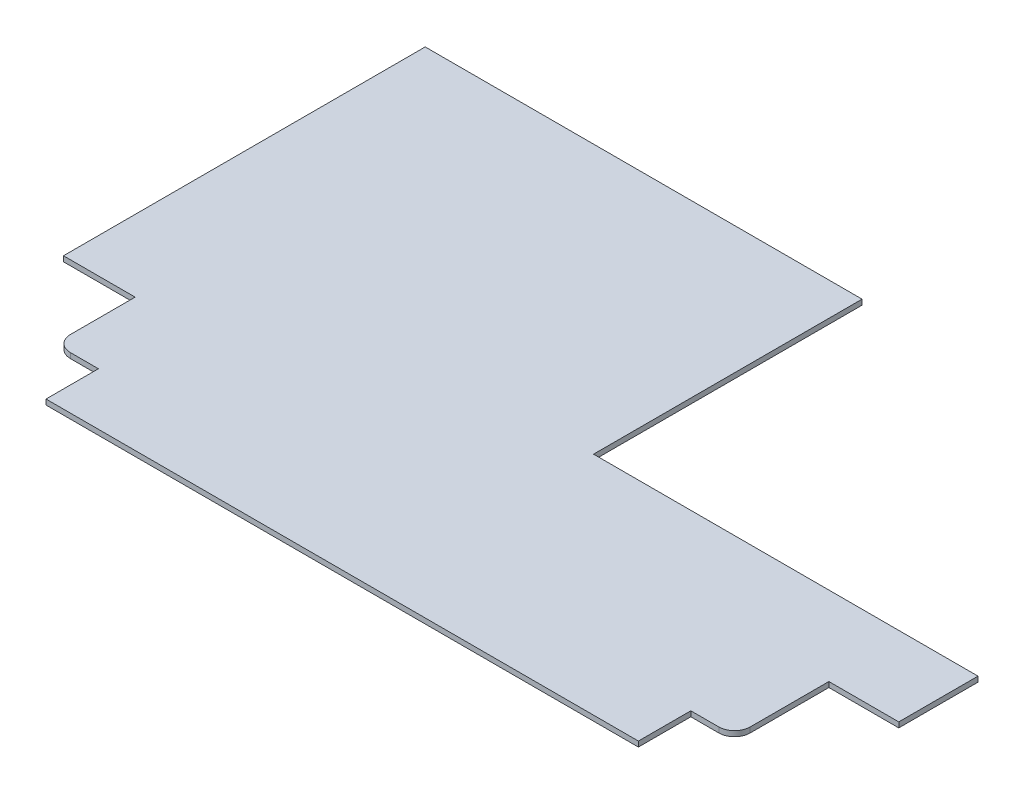
from build123d import *

# Parameters (mm, degrees)
CROQUIS1_W              = 250
CROQUIS1_H              = 250
SALIENTE_EXTRUIR1_DEPTH = 3
CROQUIS2_W              = 250
CROQUIS2_H              = 3
SALIENTE_EXTRUIR2_DEPTH = 3
CROQUIS3_W              = 220
CROQUIS3_H              = 99.34
SALIENTE_EXTRUIR4_DEPTH = 3
CROQUIS4_W              = 41
CROQUIS4_H              = 52
CORTAR_EXTRUIR1_DEPTH   = 3
CORTAR_EXTRUIR2_DEPTH   = 3
CROQUIS6_W              = 339
CROQUIS6_H              = 30
SALIENTE_EXTRUIR5_DEPTH = 3
CORTAR_EXTRUIR3_DEPTH   = 3
CROQUIS8_W              = 1
CROQUIS8_H              = 44
SALIENTE_EXTRUIR6_DEPTH = 3
SALIENTE_EXTRUIR7_DEPTH = 3
CROQUIS10_W             = 41
CROQUIS10_H             = 6
SALIENTE_EXTRUIR9_DEPTH = 3
CROQUIS11_W             = 40
CROQUIS11_H             = 1
CORTAR_EXTRUIR4_DEPTH   = 3


with BuildPart() as part:
    # Croquis1 → Saliente-Extruir1 (new body)
    with BuildSketch(Plane(origin=(0, 0, 0), x_dir=(1, 0, 0), z_dir=(0, 1, 0))):
        Rectangle(CROQUIS1_W, CROQUIS1_H)
    extrude(amount=SALIENTE_EXTRUIR1_DEPTH)

    # Croquis2 → Saliente-Extruir2 (add)
    with BuildSketch(Plane(origin=(0, 3, 0), x_dir=(1, 0, 0), z_dir=(0, 1, 0))):
        with Locations((0, 126.5)):
            Rectangle(CROQUIS2_W, CROQUIS2_H)
    extrude(amount=-SALIENTE_EXTRUIR2_DEPTH)

    # Croquis3 → Saliente-Extruir4 (add)
    with BuildSketch(Plane(origin=(0, 3, 0), x_dir=(1, 0, 0), z_dir=(0, 1, 0))):
        with Locations((235, -75.33)):
            Rectangle(CROQUIS3_W, CROQUIS3_H)
    extrude(amount=-SALIENTE_EXTRUIR4_DEPTH)

    # Croquis4 → Cortar-Extruir1 (cut)
    with BuildSketch(Plane(origin=(0, 3, 0), x_dir=(1, 0, 0), z_dir=(0, 1, 0))):
        with Locations((-104.5, -99)):
            Rectangle(CROQUIS4_W, CROQUIS4_H)
    extrude(amount=-CORTAR_EXTRUIR1_DEPTH, mode=Mode.SUBTRACT)

    # Croquis5 → Cortar-Extruir2 (cut)
    with BuildSketch(Plane(origin=(0, 3, 0), x_dir=(1, 0, 0), z_dir=(0, 1, 0))):
        with BuildLine():
            Line((-84, -116), (-84, -125))
            Line((-84, -125), (-75, -125))
            ThreePointArc((-75, -125), (-81.363961031, -122.363961031), (-84, -116))
        make_face()
    extrude(amount=-CORTAR_EXTRUIR2_DEPTH, mode=Mode.SUBTRACT)

    # Croquis6 → Saliente-Extruir5 (add)
    with BuildSketch(Plane(origin=(0, 3, 0), x_dir=(1, 0, 0), z_dir=(0, 1, 0))):
        with Locations((110.5, -140)):
            Rectangle(CROQUIS6_W, CROQUIS6_H)
    extrude(amount=-SALIENTE_EXTRUIR5_DEPTH)

    # Croquis7 → Cortar-Extruir3 (cut)
    with BuildSketch(Plane(origin=(0, 3, 0), x_dir=(1, 0, 0), z_dir=(0, 1, 0))):
        with BuildLine():
            Line((345, -72), (304, -72))
            Line((304, -72), (304, -116))
            ThreePointArc((304, -116), (301.363961031, -122.363961031), (295, -125))
            Line((295, -125), (345, -125))
            Line((345, -125), (345, -72))
        make_face()
    extrude(amount=-CORTAR_EXTRUIR3_DEPTH, mode=Mode.SUBTRACT)

    # Croquis8 → Saliente-Extruir6 (add)
    with BuildSketch(Plane(origin=(0, 3, 0), x_dir=(1, 0, 0), z_dir=(0, 1, 0))):
        with Locations((304.5, -94)):
            Rectangle(CROQUIS8_W, CROQUIS8_H)
    extrude(amount=-SALIENTE_EXTRUIR6_DEPTH)

    # Croquis9 → Saliente-Extruir7 (add)
    with BuildSketch(Plane(origin=(0, 3, 0), x_dir=(1, 0, 0), z_dir=(0, 1, 0))):
        with BuildLine():
            Line((295, -125), (296, -125))
            ThreePointArc((296, -125), (302.363961031, -122.363961031), (305, -116))
            Line((305, -116), (304, -116))
            Line((304, -116), (295, -125))
        make_face()
    extrude(amount=-SALIENTE_EXTRUIR7_DEPTH)

    # Croquis10 → Saliente-Extruir9 (add)
    with BuildSketch(Plane(origin=(0, 3, 0), x_dir=(1, 0, 0), z_dir=(0, 1, 0))):
        with Locations((-104.5, -76)):
            Rectangle(CROQUIS10_W, CROQUIS10_H)
    extrude(amount=-SALIENTE_EXTRUIR9_DEPTH)

    # Croquis11 → Cortar-Extruir4 (cut)
    with BuildSketch(Plane(origin=(0, 3, 0), x_dir=(1, 0, 0), z_dir=(0, 1, 0))):
        with Locations((325, -71.5)):
            Rectangle(CROQUIS11_W, CROQUIS11_H)
    extrude(amount=-CORTAR_EXTRUIR4_DEPTH, mode=Mode.SUBTRACT)


solid = part.part
